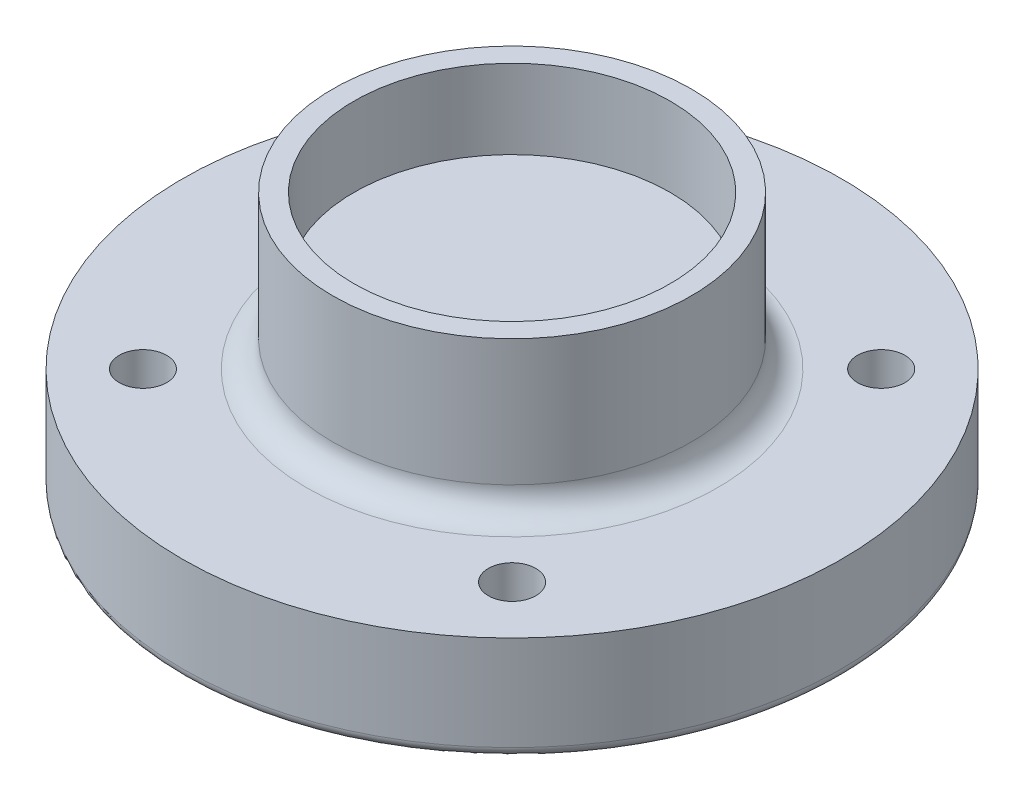
from build123d import *

# Parameters (mm, degrees)
SKETCH1_R                               = 62.5
BOSS_EXTRUDE1_DEPTH                     = 20
SKETCH2_R                               = 34
BOSS_EXTRUDE2_DEPTH                     = 29
SKETCH6_R                               = 30
CUT_EXTRUDE1_DEPTH                      = 15
FILLET1_R                               = 5
CBORE_FOR_M8_HEX_HEAD_BOLT1_D           = 9
CBORE_FOR_M8_HEX_HEAD_BOLT1_CBORE_D     = 18.011
CBORE_FOR_M8_HEX_HEAD_BOLT1_CBORE_DEPTH = 5.3
FILLET2_R                               = 2


with BuildPart() as part:
    # Sketch1 → Boss-Extrude1 (new body)
    with BuildSketch(Plane(origin=(0, 0, 0), x_dir=(1, 0, 0), z_dir=(0, 1, 0))):
        with Locations(Location((0, 0, 0), (0, 0, 270))):
            Circle(SKETCH1_R)
    extrude(amount=BOSS_EXTRUDE1_DEPTH)

    # Sketch2 → Boss-Extrude2 (add)
    with BuildSketch(Plane(origin=(0, 20, 0), x_dir=(1, 0, 0), z_dir=(0, 1, 0))):
        with Locations(Location((0, 0, 0), (0, 0, 90))):
            Circle(SKETCH2_R)
    extrude(amount=BOSS_EXTRUDE2_DEPTH)

    # Sketch6 → Cut-Extrude1 (cut)
    with BuildSketch(Plane(origin=(0, 49, 0), x_dir=(1, 0, 0), z_dir=(0, 1, 0))):
        with Locations(Location((0, 0, 0), (0, 0, 270))):
            Circle(SKETCH6_R)
    extrude(amount=-CUT_EXTRUDE1_DEPTH, mode=Mode.SUBTRACT)

    # Fillet1
    fillet1_edges = [part.edges().sort_by_distance(p)[0] for p in [
        (0, 20, 34),
    ]]
    fillet(fillet1_edges, radius=FILLET1_R)

    # CBORE for M8 Hex Head Bolt1 (through all)
    with Locations(Plane(origin=(-35, 0, 35), x_dir=(0, 0, -1), z_dir=(0, -1, 0))):
        with Locations((0, 0), (0, 70), (70, 70), (70, 0)):
            CounterBoreHole(CBORE_FOR_M8_HEX_HEAD_BOLT1_D / 2, CBORE_FOR_M8_HEX_HEAD_BOLT1_CBORE_D / 2, CBORE_FOR_M8_HEX_HEAD_BOLT1_CBORE_DEPTH)

    # Fillet2
    fillet2_edges = [part.edges().sort_by_distance(p)[0] for p in [
        (0, 0, -62.5),
    ]]
    fillet(fillet2_edges, radius=FILLET2_R)


solid = part.part
